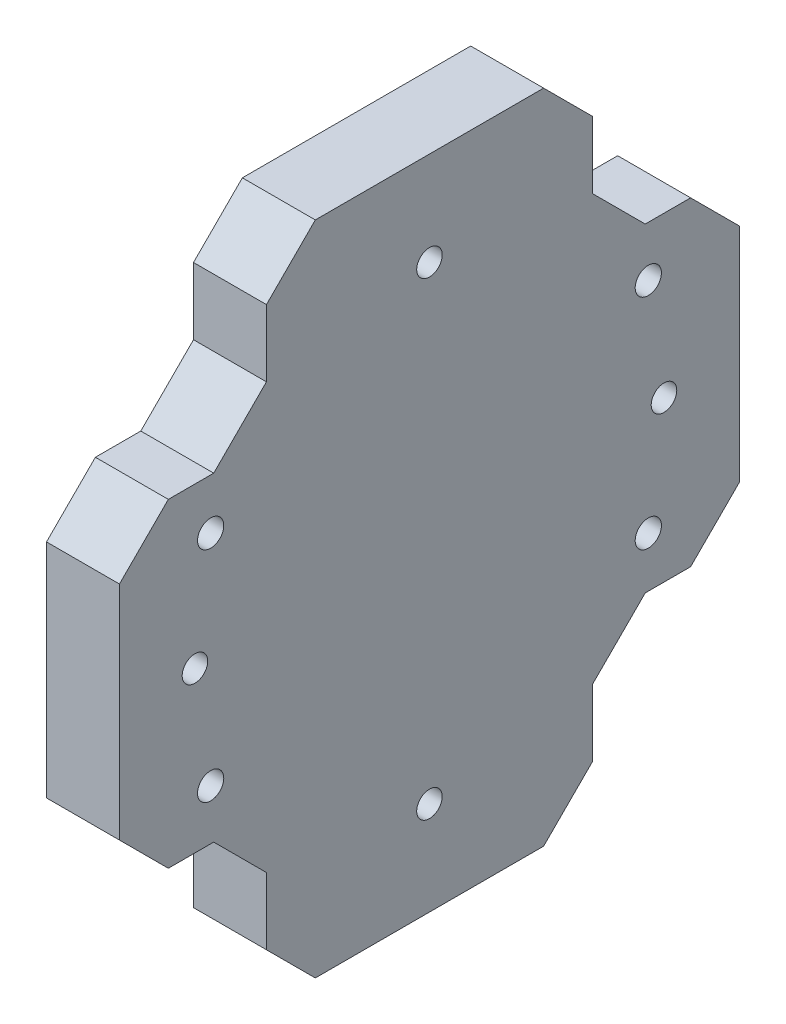
from build123d import *

# Parameters (mm, degrees)
SKETCH1_R           = 1.75
SKETCH1_R_2         = 1.798521792
BOSS_EXTRUDE1_DEPTH = 10
SKETCH2_R           = 2.65
CUT_EXTRUDE1_DEPTH  = 3.5


with BuildPart() as part:
    # Sketch1 → Boss-Extrude1 (new body)
    with BuildSketch(Plane.YZ):
        Polygon((-45, -15.65), (-45, 15.65), (-38.3, 22.35), (-29.12737367, 22.35), (-21.9, 29.57737367), (-21.9, 35.8), (-15.2, 42.5), (15.2, 42.5), (21.9, 35.8), (21.9, 29.57737367), (29.12737367, 22.35), (38.3, 22.35), (45, 15.65), (45, -15.65), (38.3, -22.35), (29.12737367, -22.35), (21.9, -29.57737367), (21.9, -35.8), (15.2, -42.5), (-15.2, -42.5), (-21.9, -35.8), (-21.9, -29.57737367), (-29.12737367, -22.35), (-38.3, -22.35), align=None)
        with Locations(Location((0, 32.15, 0), (0, 0, 270))):
            Circle(SKETCH1_R, mode=Mode.SUBTRACT)
        with Locations(Location((-32.15, 0, 0), (0, 0, 270))):
            Circle(SKETCH1_R, mode=Mode.SUBTRACT)
        with Locations(Location((0, -32.15, 0), (0, 0, 270))):
            Circle(SKETCH1_R, mode=Mode.SUBTRACT)
        with Locations(Location((32.15, 0, 0), (0, 0, 270))):
            Circle(SKETCH1_R, mode=Mode.SUBTRACT)
        with Locations(Location((-15, 30, 0), (0, 0, 270))):
            Circle(SKETCH1_R_2, mode=Mode.SUBTRACT)
        with Locations(Location((15, 30, 0), (0, 0, 270))):
            Circle(SKETCH1_R_2, mode=Mode.SUBTRACT)
        with Locations(Location((15, -30, 0), (0, 0, 270))):
            Circle(SKETCH1_R_2, mode=Mode.SUBTRACT)
        with Locations(Location((-15, -30, 0), (0, 0, 270))):
            Circle(SKETCH1_R_2, mode=Mode.SUBTRACT)
    extrude(amount=BOSS_EXTRUDE1_DEPTH)

    # Sketch2 → Cut-Extrude1 (cut)
    with BuildSketch(Plane(origin=(0, 0, 0), x_dir=(0, -1, 0), z_dir=(-1, 0, 0))):
        with Locations(Location((-15, 30, 0), (0, 0, 90))):
            Circle(SKETCH2_R)
        with Locations(Location((15, 30, 0), (0, 0, 90))):
            Circle(SKETCH2_R)
        with Locations(Location((15, -30, 0), (0, 0, 90))):
            Circle(SKETCH2_R)
        with Locations(Location((-15, -30, 0), (0, 0, 90))):
            Circle(SKETCH2_R)
    extrude(amount=-CUT_EXTRUDE1_DEPTH, mode=Mode.SUBTRACT)


solid = part.part
